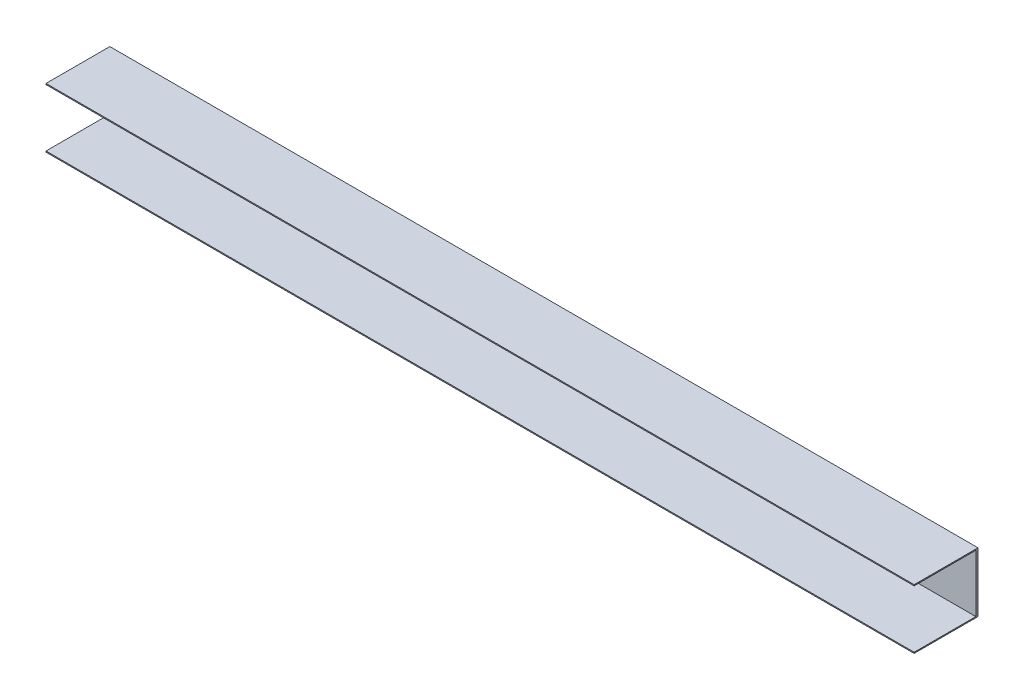
from build123d import *

# Parameters (mm, degrees)
SKETCH1_W           = 408
SKETCH1_H           = 28
BOSS_EXTRUDE1_DEPTH = 30
SKETCH2_W           = 427
SKETCH2_H           = 27
CUT_EXTRUDE1_DEPTH  = 29


with BuildPart() as part:
    # Sketch1 → Boss-Extrude1 (new body)
    with BuildSketch(Plane.XY):
        Rectangle(SKETCH1_W, SKETCH1_H)
    extrude(amount=BOSS_EXTRUDE1_DEPTH)

    # Sketch2 → Cut-Extrude1 (cut)
    with BuildSketch(Plane.XY.offset(30)):
        Rectangle(SKETCH2_W, SKETCH2_H)
    extrude(amount=-CUT_EXTRUDE1_DEPTH, mode=Mode.SUBTRACT)


solid = part.part
